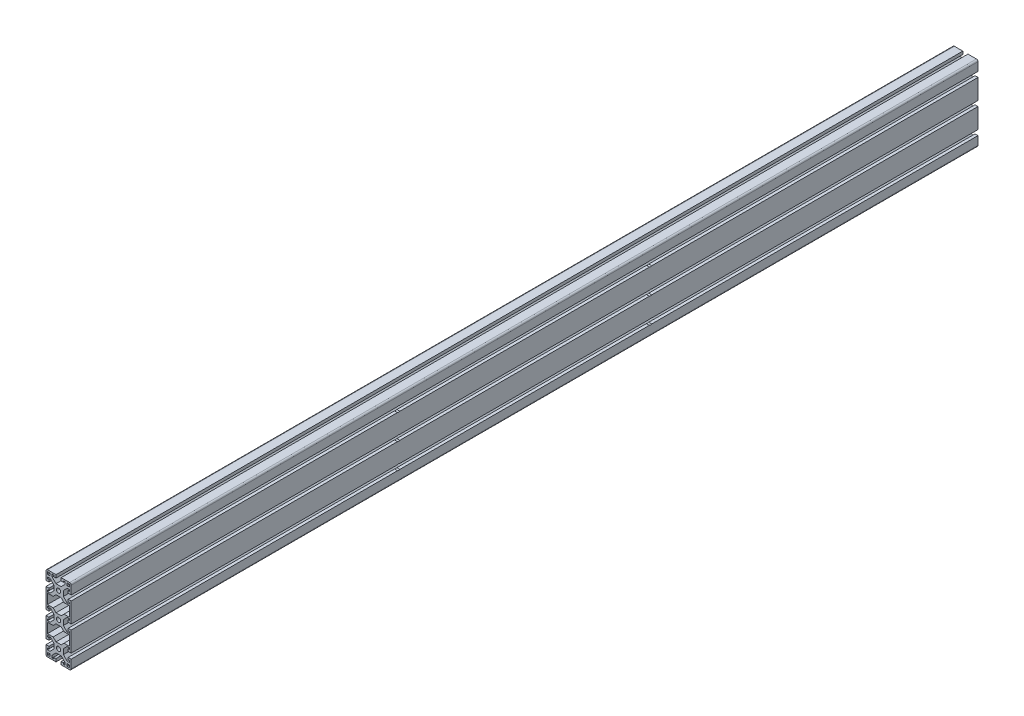
from build123d import *

# Parameters (mm, degrees)
SKETCH2_W                      = 3.9
SKETCH2_H                      = 3.9
F_40_SERIES_TS40_120LM_1_DEPTH = 1440
M8X1_25_TAPPED_HOLE1_D         = 6.8
M8X1_25_TAPPED_HOLE1_DEPTH     = 30
M8X1_25_TAPPED_HOLE1_TIP       = 2.042926105
M8X1_25_TAPPED_HOLE2_D         = 6.8
M8X1_25_TAPPED_HOLE2_DEPTH     = 30
M8X1_25_TAPPED_HOLE2_TIP       = 2.042926105
M8_CLEARANCE_HOLE1_D           = 9


with BuildPart() as part:
    # Sketch2 → 40 series TS40-120LM(1) (new body)
    with BuildSketch(Plane(origin=(0, 0, 720), x_dir=(-1, 0, 0), z_dir=(0, 0, -1))):
        with BuildLine():
            Line((15.3, -35.9), (20, -35.9))
            Line((20, -35.9), (20, -4.1))
            Line((20, -4.1), (15.3, -4.1))
            Line((15.3, -4.1), (15.3, -7.6))
            Line((15.3, -7.6), (17.65, -7.6))
            Line((17.65, -7.6), (17.65, -10.1))
            Line((17.65, -10.1), (13.6, -10.1))
            Line((13.6, -10.1), (7.6, -4.1))
            Line((7.6, -4.1), (7.6, 4.1))
            Line((7.6, 4.1), (13.6, 10.1))
            Line((13.6, 10.1), (17.65, 10.1))
            Line((17.65, 10.1), (17.65, 7.6))
            Line((17.65, 7.6), (15.3, 7.6))
            Line((15.3, 7.6), (15.3, 4.1))
            Line((15.3, 4.1), (20, 4.1))
            Line((20, 4.1), (20, 35.9))
            Line((20, 35.9), (15.3, 35.9))
            Line((15.3, 35.9), (15.3, 32.4))
            Line((15.3, 32.4), (17.65, 32.4))
            Line((17.65, 32.4), (17.65, 29.9))
            Line((17.65, 29.9), (13.6, 29.9))
            Line((13.6, 29.9), (7.6, 35.9))
            Line((7.6, 35.9), (7.6, 44.1))
            Line((7.6, 44.1), (13.6, 50.1))
            Line((13.6, 50.1), (17.65, 50.1))
            Line((17.65, 50.1), (17.65, 47.6))
            Line((17.65, 47.6), (15.3, 47.6))
            Line((15.3, 47.6), (15.3, 44.1))
            Line((15.3, 44.1), (20, 44.1))
            Line((20, 44.1), (20, 57.5))
            ThreePointArc((20, 57.5), (19.267766953, 59.267766953), (17.5, 60))
            Line((17.5, 60), (4.1, 60))
            Line((4.1, 60), (4.1, 55.3))
            Line((4.1, 55.3), (7.6, 55.3))
            Line((7.6, 55.3), (7.6, 57.65))
            Line((7.6, 57.65), (10.1, 57.65))
            Line((10.1, 57.65), (10.1, 53.6))
            Line((10.1, 53.6), (4.1, 47.6))
            Line((4.1, 47.6), (-4.1, 47.6))
            Line((-4.1, 47.6), (-10.1, 53.6))
            Line((-10.1, 53.6), (-10.1, 57.65))
            Line((-10.1, 57.65), (-7.6, 57.65))
            Line((-7.6, 57.65), (-7.6, 55.3))
            Line((-7.6, 55.3), (-4.1, 55.3))
            Line((-4.1, 55.3), (-4.1, 60))
            Line((-4.1, 60), (-17.5, 60))
            ThreePointArc((-17.5, 60), (-19.267766953, 59.267766953), (-20, 57.5))
            Line((-20, 57.5), (-20, 44.1))
            Line((-20, 44.1), (-15.3, 44.1))
            Line((-15.3, 44.1), (-15.3, 47.6))
            Line((-15.3, 47.6), (-17.65, 47.6))
            Line((-17.65, 47.6), (-17.65, 50.1))
            Line((-17.65, 50.1), (-13.6, 50.1))
            Line((-13.6, 50.1), (-7.6, 44.1))
            Line((-7.6, 44.1), (-7.6, 35.9))
            Line((-7.6, 35.9), (-13.6, 29.9))
            Line((-13.6, 29.9), (-17.65, 29.9))
            Line((-17.65, 29.9), (-17.65, 32.4))
            Line((-17.65, 32.4), (-15.3, 32.4))
            Line((-15.3, 32.4), (-15.3, 35.9))
            Line((-15.3, 35.9), (-20, 35.9))
            Line((-20, 35.9), (-20, 4.1))
            Line((-20, 4.1), (-15.3, 4.1))
            Line((-15.3, 4.1), (-15.3, 7.6))
            Line((-15.3, 7.6), (-17.65, 7.6))
            Line((-17.65, 7.6), (-17.65, 10.1))
            Line((-17.65, 10.1), (-13.6, 10.1))
            Line((-13.6, 10.1), (-7.6, 4.1))
            Line((-7.6, 4.1), (-7.6, -4.1))
            Line((-7.6, -4.1), (-13.6, -10.1))
            Line((-13.6, -10.1), (-17.65, -10.1))
            Line((-17.65, -10.1), (-17.65, -7.6))
            Line((-17.65, -7.6), (-15.3, -7.6))
            Line((-15.3, -7.6), (-15.3, -4.1))
            Line((-15.3, -4.1), (-20, -4.1))
            Line((-20, -4.1), (-20, -35.9))
            Line((-20, -35.9), (-15.3, -35.9))
            Line((-15.3, -35.9), (-15.3, -32.4))
            Line((-15.3, -32.4), (-17.65, -32.4))
            Line((-17.65, -32.4), (-17.65, -29.9))
            Line((-17.65, -29.9), (-13.6, -29.9))
            Line((-13.6, -29.9), (-7.6, -35.9))
            Line((-7.6, -35.9), (-7.6, -44.1))
            Line((-7.6, -44.1), (-13.6, -50.1))
            Line((-13.6, -50.1), (-17.65, -50.1))
            Line((-17.65, -50.1), (-17.65, -47.6))
            Line((-17.65, -47.6), (-15.3, -47.6))
            Line((-15.3, -47.6), (-15.3, -44.1))
            Line((-15.3, -44.1), (-20, -44.1))
            Line((-20, -44.1), (-20, -57.5))
            ThreePointArc((-20, -57.5), (-19.267766953, -59.267766953), (-17.5, -60))
            Line((-17.5, -60), (-4.1, -60))
            Line((-4.1, -60), (-4.1, -55.3))
            Line((-4.1, -55.3), (-7.6, -55.3))
            Line((-7.6, -55.3), (-7.6, -57.65))
            Line((-7.6, -57.65), (-10.1, -57.65))
            Line((-10.1, -57.65), (-10.1, -53.6))
            Line((-10.1, -53.6), (-4.1, -47.6))
            Line((-4.1, -47.6), (4.1, -47.6))
            Line((4.1, -47.6), (10.1, -53.6))
            Line((10.1, -53.6), (10.1, -57.65))
            Line((10.1, -57.65), (7.6, -57.65))
            Line((7.6, -57.65), (7.6, -55.3))
            Line((7.6, -55.3), (4.1, -55.3))
            Line((4.1, -55.3), (4.1, -60))
            Line((4.1, -60), (17.5, -60))
            ThreePointArc((17.5, -60), (19.267766953, -59.267766953), (20, -57.5))
            Line((20, -57.5), (20, -44.1))
            Line((20, -44.1), (15.3, -44.1))
            Line((15.3, -44.1), (15.3, -47.6))
            Line((15.3, -47.6), (17.65, -47.6))
            Line((17.65, -47.6), (17.65, -50.1))
            Line((17.65, -50.1), (13.6, -50.1))
            Line((13.6, -50.1), (7.6, -44.1))
            Line((7.6, -44.1), (7.6, -35.9))
            Line((7.6, -35.9), (13.6, -29.9))
            Line((13.6, -29.9), (17.65, -29.9))
            Line((17.65, -29.9), (17.65, -32.4))
            Line((17.65, -32.4), (15.3, -32.4))
            Line((15.3, -32.4), (15.3, -35.9))
        make_face()
        Polygon((-4.1, -7.6), (4.1, -7.6), (8.6, -12.1), (17.65, -12.1), (17.65, -27.9), (8.6, -27.9), (4.1, -32.4), (-4.1, -32.4), (-8.6, -27.9), (-17.65, -27.9), (-17.65, -12.1), (-8.6, -12.1), align=None, mode=Mode.SUBTRACT)
        Polygon((-4.1, 7.6), (-8.6, 12.1), (-17.65, 12.1), (-17.65, 27.9), (-8.6, 27.9), (-4.1, 32.4), (4.1, 32.4), (8.6, 27.9), (17.65, 27.9), (17.65, 12.1), (8.6, 12.1), (4.1, 7.6), align=None, mode=Mode.SUBTRACT)
        with Locations((15.55, -55.55)):
            Rectangle(SKETCH2_W, SKETCH2_H, mode=Mode.SUBTRACT)
        with Locations((-15.55, -55.55)):
            Rectangle(SKETCH2_W, SKETCH2_H, mode=Mode.SUBTRACT)
        with Locations((-15.55, 55.55)):
            Rectangle(SKETCH2_W, SKETCH2_H, mode=Mode.SUBTRACT)
        with Locations((15.55, 55.55)):
            Rectangle(SKETCH2_W, SKETCH2_H, mode=Mode.SUBTRACT)
        with BuildLine():
            ThreePointArc((0, -43.35), (3.35, -40), (0, -36.65))
            ThreePointArc((0, -36.65), (-3.35, -40), (0, -43.35))
        make_face(mode=Mode.SUBTRACT)
        with BuildLine():
            ThreePointArc((3.35, 0), (0, -3.35), (-3.35, 0))
            ThreePointArc((-3.35, 0), (0, 3.35), (3.35, 0))
        make_face(mode=Mode.SUBTRACT)
        with BuildLine():
            ThreePointArc((0, 43.35), (-3.35, 40), (0, 36.65))
            ThreePointArc((0, 36.65), (3.35, 40), (0, 43.35))
        make_face(mode=Mode.SUBTRACT)
    extrude(amount=F_40_SERIES_TS40_120LM_1_DEPTH)

    # M8x1.25 Tapped Hole1
    with Locations(Plane.XY.offset(720)):
        with Locations((0, 40), (0, 0), (0, -40)):
            Hole(M8X1_25_TAPPED_HOLE1_D / 2, depth=M8X1_25_TAPPED_HOLE1_DEPTH)
            with Locations((0, 0, -(M8X1_25_TAPPED_HOLE1_DEPTH + M8X1_25_TAPPED_HOLE1_TIP / 2))):  # 118° drill point
                Cone(0, M8X1_25_TAPPED_HOLE1_D / 2, M8X1_25_TAPPED_HOLE1_TIP, mode=Mode.SUBTRACT)

    # M8x1.25 Tapped Hole2
    with Locations(Plane(origin=(0, 0, -720), x_dir=(-1, 0, 0), z_dir=(0, 0, -1))):
        with Locations((0, 40), (0, 0), (0, -40)):
            Hole(M8X1_25_TAPPED_HOLE2_D / 2, depth=M8X1_25_TAPPED_HOLE2_DEPTH)
            with Locations((0, 0, -(M8X1_25_TAPPED_HOLE2_DEPTH + M8X1_25_TAPPED_HOLE2_TIP / 2))):  # 118° drill point
                Cone(0, M8X1_25_TAPPED_HOLE2_D / 2, M8X1_25_TAPPED_HOLE2_TIP, mode=Mode.SUBTRACT)

    # M8 Clearance Hole1 (through all)
    with Locations(Plane.ZY.offset(20)):
        with Locations((-200, 40), (-200, -40), (200, 40), (200, -40), (-200, 0), (200, 0)):
            Hole(M8_CLEARANCE_HOLE1_D / 2)


solid = part.part
